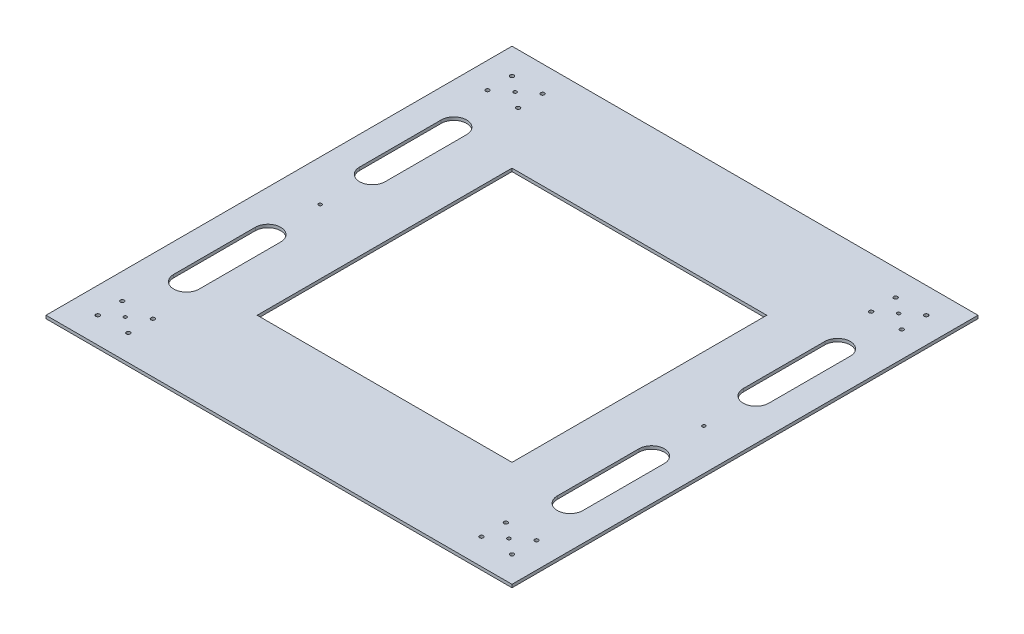
from build123d import *

# Parameters (mm, degrees)
SKETCH1_W           = 457.2
SKETCH1_H           = 457.2
BOSS_EXTRUDE1_DEPTH = 3
SKETCH2_R           = 1.875
CUT_EXTRUDE2_DEPTH  = 324.303139484
SKETCH3_R           = 1.625
CUT_EXTRUDE3_DEPTH  = 324.303139484
CUT_EXTRUDE4_DEPTH  = 324.303139484
SKETCH5_W           = 250
SKETCH5_H           = 250
CUT_EXTRUDE5_DEPTH  = 324.303139484


with BuildPart() as part:
    # Sketch1 → Boss-Extrude1 (new body)
    with BuildSketch(Plane(origin=(0, 0, 0), x_dir=(1, 0, 0), z_dir=(0, 1, 0))):
        Rectangle(SKETCH1_W, SKETCH1_H)
    extrude(amount=BOSS_EXTRUDE1_DEPTH)

    # Sketch2 → Cut-Extrude2 (cut, through all)
    with BuildSketch(Plane(origin=(0, 3, 0), x_dir=(1, 0, 0), z_dir=(0, 1, 0))):
        with Locations(Location((-173.2, 203.2, 0), (0, 0, 90))):
            Circle(SKETCH2_R)
        with Locations(Location((173.2, 203.2, 0), (0, 0, 270))):
            Circle(SKETCH2_R)
        with Locations(Location((-173.2, -203.2, 0), (0, 0, 270))):
            Circle(SKETCH2_R)
        with Locations(Location((-203.2, 203.2, 0), (0, 0, 270))):
            Circle(SKETCH2_R)
        with Locations(Location((-203.2, 179.2, 0), (0, 0, 270))):
            Circle(SKETCH2_R)
        with Locations(Location((-173.2, 179.2, 0), (0, 0, 270))):
            Circle(SKETCH2_R)
        with Locations(Location((-173.2, -179.2, 0), (0, 0, 90))):
            Circle(SKETCH2_R)
        with Locations(Location((-203.2, -179.2, 0), (0, 0, 90))):
            Circle(SKETCH2_R)
        with Locations(Location((-203.2, -203.2, 0), (0, 0, 90))):
            Circle(SKETCH2_R)
        with Locations(Location((173.2, 179.2, 0), (0, 0, 90))):
            Circle(SKETCH2_R)
        with Locations(Location((203.2, 179.2, 0), (0, 0, 90))):
            Circle(SKETCH2_R)
        with Locations(Location((203.2, 203.2, 0), (0, 0, 90))):
            Circle(SKETCH2_R)
        with Locations(Location((203.2, -203.2, 0), (0, 0, 270))):
            Circle(SKETCH2_R)
        with Locations(Location((203.2, -179.2, 0), (0, 0, 270))):
            Circle(SKETCH2_R)
        with Locations(Location((173.2, -179.2, 0), (0, 0, 270))):
            Circle(SKETCH2_R)
        with Locations(Location((173.2, -203.2, 0), (0, 0, 90))):
            Circle(SKETCH2_R)
    extrude(amount=-CUT_EXTRUDE2_DEPTH, mode=Mode.SUBTRACT)

    # Sketch3 → Cut-Extrude3 (cut, through all)
    with BuildSketch(Plane(origin=(0, 3, 0), x_dir=(1, 0, 0), z_dir=(0, 1, 0))):
        with Locations(Location((-188.2, 191.2, 0), (0, 0, 270))):
            Circle(SKETCH3_R)
        with Locations(Location((-188.2, -191.2, 0), (0, 0, 90))):
            Circle(SKETCH3_R)
        with Locations(Location((188.2, 191.2, 0), (0, 0, 90))):
            Circle(SKETCH3_R)
        with Locations(Location((188.2, -191.2, 0), (0, 0, 270))):
            Circle(SKETCH3_R)
        with Locations(Location((-188.2, 0, 0), (0, 0, 270))):
            Circle(SKETCH3_R)
        with Locations(Location((188.2, 0, 0), (0, 0, 90))):
            Circle(SKETCH3_R)
    extrude(amount=-CUT_EXTRUDE3_DEPTH, mode=Mode.SUBTRACT)

    # Sketch4 → Cut-Extrude4 (cut, through all)
    with BuildSketch(Plane(origin=(0, 3, 0), x_dir=(1, 0, 0), z_dir=(0, 1, 0))):
        with BuildLine():
            Line((-200.7, 131.2), (-200.7, 51.2))
            ThreePointArc((-200.7, 51.2), (-188.2, 38.7), (-175.7, 51.2))
            Line((-175.7, 51.2), (-175.7, 131.2))
            ThreePointArc((-175.7, 131.2), (-188.2, 143.7), (-200.7, 131.2))
        make_face()
        with BuildLine():
            Line((-175.7, -131.2), (-175.7, -51.2))
            ThreePointArc((-175.7, -51.2), (-188.2, -38.7), (-200.7, -51.2))
            Line((-200.7, -51.2), (-200.7, -131.2))
            ThreePointArc((-200.7, -131.2), (-188.2, -143.7), (-175.7, -131.2))
        make_face()
        with BuildLine():
            Line((200.7, -131.2), (200.7, -51.2))
            ThreePointArc((200.7, -51.2), (188.2, -38.7), (175.7, -51.2))
            Line((175.7, -51.2), (175.7, -131.2))
            ThreePointArc((175.7, -131.2), (188.2, -143.7), (200.7, -131.2))
        make_face()
        with BuildLine():
            Line((175.7, 131.2), (175.7, 51.2))
            ThreePointArc((175.7, 51.2), (188.2, 38.7), (200.7, 51.2))
            Line((200.7, 51.2), (200.7, 131.2))
            ThreePointArc((200.7, 131.2), (188.2, 143.7), (175.7, 131.2))
        make_face()
    extrude(amount=-CUT_EXTRUDE4_DEPTH, mode=Mode.SUBTRACT)

    # Sketch5 → Cut-Extrude5 (cut, through all)
    with BuildSketch(Plane(origin=(0, 3, 0), x_dir=(1, 0, 0), z_dir=(0, 1, 0))):
        Rectangle(SKETCH5_W, SKETCH5_H)
    extrude(amount=-CUT_EXTRUDE5_DEPTH, mode=Mode.SUBTRACT)


solid = part.part
